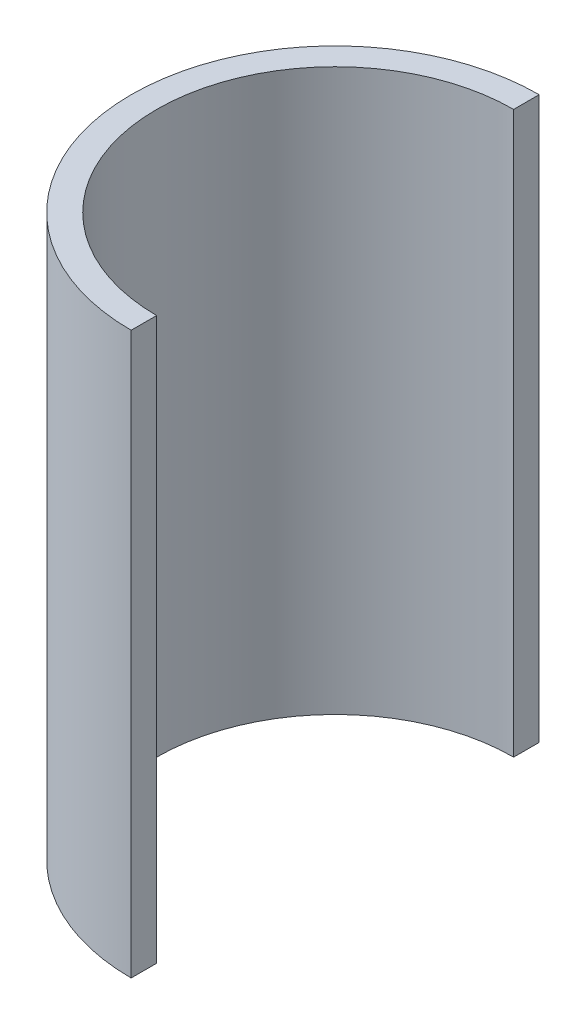
from build123d import *

# Parameters (mm, degrees)
BOSS_EXTRUDE1_DEPTH = 110


with BuildPart() as part:
    # Sketch1 → Boss-Extrude1 (new body)
    with BuildSketch(Plane(origin=(0, 0, 0), x_dir=(1, 0, 0), z_dir=(0, 1, 0))):
        with BuildLine():
            Line((0, 40), (0, 35))
            ThreePointArc((0, 35), (-35, 0), (0, -35))
            Line((0, -35), (0, -40))
            ThreePointArc((0, -40), (-40, 0), (0, 40))
        make_face()
    extrude(amount=BOSS_EXTRUDE1_DEPTH)


solid = part.part
